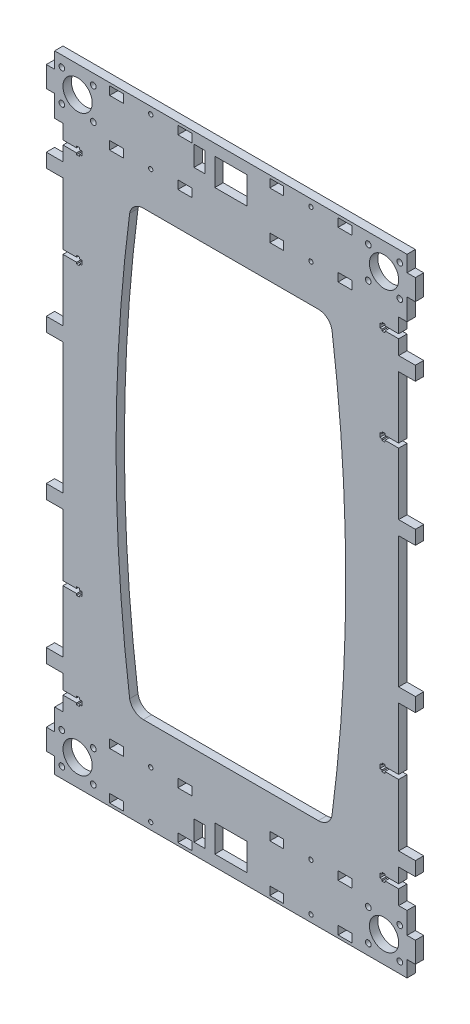
from build123d import *

# Parameters (mm, degrees)
SKETCH_1_R      = 1.55
SKETCH_1_R_2    = 2.05
SKETCH_1_R_3    = 10.5
SKETCH_1_W      = 10
SKETCH_1_H      = 6.000012
SKETCH_1_W_2    = 9.999998
SKETCH_1_H_2    = 5.999998
SKETCH_1_W_3    = 9.999999
SKETCH_1_W_4    = 8
SKETCH_1_H_3    = 14.5
SKETCH_1_W_5    = 23
SKETCH_1_H_4    = 19.5
EXTRUDE_1_DEPTH = 6


with BuildPart() as part:
    # Эскиз1 → Бобышка-Вытянуть1 (new body)
    with BuildSketch(Plane.XY):
        Polygon((-120.499999, 47), (-132.500001, 47), (-132.500001, 57), (-120.499999, 57), (-120.499999, 101.449999), (-110.699997, 101.449999), (-110.699997, 100.249999), (-108.499998, 100.249999), (-108.499998, 101.449999), (-107.000002, 101.449999), (-107.000002, 104.550001), (-108.499998, 104.550001), (-108.499998, 105.749999), (-110.699997, 105.749999), (-110.699997, 104.550001), (-120.499999, 104.550001), (-120.499999, 148.999997), (-132.500001, 148.999997), (-132.500001, 159.000003), (-120.499999, 159.000003), (-120.499999, 169.450001), (-110.7, 169.450001), (-110.7, 168.250003), (-108.5, 168.250003), (-108.5, 169.450001), (-106.999996, 169.450001), (-106.999996, 172.550001), (-108.5, 172.550001), (-108.5, 173.749999), (-110.7, 173.749999), (-110.7, 172.550001), (-120.499999, 172.550001), (-120.499999, 182.999999), (-126.499996, 182.999999), (-126.499996, 198.499993), (-132.499998, 198.499993), (-132.499998, 213.499994), (-126.499996, 213.499994), (-126.499996, 224.999995), (126.499997, 224.999995), (126.499997, 213.499994), (132.499999, 213.499994), (132.499999, 198.499993), (126.499997, 198.499993), (126.499997, 182.999999), (120.5, 182.999999), (120.5, 172.550001), (110.7, 172.550001), (110.7, 173.749999), (108.5, 173.749999), (108.5, 172.550001), (106.999997, 172.550001), (106.999997, 169.450001), (108.5, 169.450001), (108.5, 168.250003), (110.7, 168.250003), (110.7, 169.450001), (120.5, 169.450001), (120.5, 159.000003), (132.500002, 159.000003), (132.500002, 148.999997), (120.5, 148.999997), (120.5, 104.550001), (110.699998, 104.550001), (110.699998, 105.749999), (108.499998, 105.749999), (108.499998, 104.550001), (107.000003, 104.550001), (107.000003, 101.449999), (108.499998, 101.449999), (108.499998, 100.249999), (110.699998, 100.249999), (110.699998, 101.449999), (120.5, 101.449999), (120.5, 57), (132.500002, 57), (132.500002, 47), (120.5, 47), (120.499999, -47), (132.500001, -47), (132.500001, -57), (120.499999, -57), (120.499999, -101.449999), (110.699997, -101.449999), (110.699997, -100.249999), (108.499998, -100.249999), (108.499998, -101.449999), (107.000002, -101.449999), (107.000002, -104.550001), (108.499998, -104.550001), (108.499998, -105.749999), (110.699997, -105.749999), (110.699997, -104.550001), (120.499999, -104.550001), (120.499999, -148.999997), (132.500001, -148.999997), (132.500001, -159.000003), (120.499999, -159.000003), (120.499999, -169.450001), (110.7, -169.450001), (110.7, -168.250003), (108.5, -168.250003), (108.5, -169.450001), (106.999996, -169.450001), (106.999996, -172.550001), (108.5, -172.550001), (108.5, -173.749999), (110.7, -173.749999), (110.7, -172.550001), (120.499999, -172.550001), (120.499999, -182.999999), (126.499996, -182.999999), (126.499996, -198.499993), (132.499998, -198.499993), (132.499998, -213.499994), (126.499996, -213.499994), (126.499996, -224.999995), (-126.499997, -224.999995), (-126.499997, -213.499994), (-132.499999, -213.499994), (-132.499999, -198.499993), (-126.499997, -198.499993), (-126.499997, -182.999999), (-120.5, -182.999999), (-120.5, -172.550001), (-110.7, -172.550001), (-110.7, -173.749999), (-108.5, -173.749999), (-108.5, -172.550001), (-106.999997, -172.550001), (-106.999997, -169.450001), (-108.5, -169.450001), (-108.5, -168.250003), (-110.7, -168.250003), (-110.7, -169.450001), (-120.5, -169.450001), (-120.5, -159.000003), (-132.500002, -159.000003), (-132.500002, -148.999997), (-120.5, -148.999997), (-120.5, -104.550001), (-110.699998, -104.550001), (-110.699998, -105.749999), (-108.499998, -105.749999), (-108.499998, -104.550001), (-107.000003, -104.550001), (-107.000003, -101.449999), (-108.499998, -101.449999), (-108.499998, -100.249999), (-110.699998, -100.249999), (-110.699998, -101.449999), (-120.5, -101.449999), (-120.5, -57), (-132.500002, -57), (-132.500002, -47), (-120.5, -47), align=None)
        with Locations((-57.5, 186)):
            Circle(SKETCH_1_R, mode=Mode.SUBTRACT)
        with Locations((-98.7, 194.7)):
            Circle(SKETCH_1_R_2, mode=Mode.SUBTRACT)
        with Locations((-98.7, 217.3)):
            Circle(SKETCH_1_R_2, mode=Mode.SUBTRACT)
        with Locations((-110, 206)):
            Circle(SKETCH_1_R_3, mode=Mode.SUBTRACT)
        with Locations((-57.5, 220)):
            Circle(SKETCH_1_R, mode=Mode.SUBTRACT)
        with Locations((-121.3, 217.3)):
            Circle(SKETCH_1_R_2, mode=Mode.SUBTRACT)
        with Locations((-121.3, 194.7)):
            Circle(SKETCH_1_R_2, mode=Mode.SUBTRACT)
        with Locations((57.5, 186)):
            Circle(SKETCH_1_R, mode=Mode.SUBTRACT)
        with Locations((98.7, 194.7)):
            Circle(SKETCH_1_R_2, mode=Mode.SUBTRACT)
        with Locations((98.7, 217.3)):
            Circle(SKETCH_1_R_2, mode=Mode.SUBTRACT)
        with Locations((110, 206)):
            Circle(SKETCH_1_R_3, mode=Mode.SUBTRACT)
        with Locations((57.5, 220)):
            Circle(SKETCH_1_R, mode=Mode.SUBTRACT)
        with Locations((121.3, 217.3)):
            Circle(SKETCH_1_R_2, mode=Mode.SUBTRACT)
        with Locations((121.3, 194.7)):
            Circle(SKETCH_1_R_2, mode=Mode.SUBTRACT)
        with Locations((57.5, -186)):
            Circle(SKETCH_1_R, mode=Mode.SUBTRACT)
        with Locations((98.7, -194.7)):
            Circle(SKETCH_1_R_2, mode=Mode.SUBTRACT)
        with Locations((98.7, -217.3)):
            Circle(SKETCH_1_R_2, mode=Mode.SUBTRACT)
        with Locations((110, -206)):
            Circle(SKETCH_1_R_3, mode=Mode.SUBTRACT)
        with Locations((57.5, -220)):
            Circle(SKETCH_1_R, mode=Mode.SUBTRACT)
        with Locations((121.3, -217.3)):
            Circle(SKETCH_1_R_2, mode=Mode.SUBTRACT)
        with Locations((121.3, -194.7)):
            Circle(SKETCH_1_R_2, mode=Mode.SUBTRACT)
        with Locations((-57.5, -186)):
            Circle(SKETCH_1_R, mode=Mode.SUBTRACT)
        with Locations((-98.7, -194.7)):
            Circle(SKETCH_1_R_2, mode=Mode.SUBTRACT)
        with Locations((-98.7, -217.3)):
            Circle(SKETCH_1_R_2, mode=Mode.SUBTRACT)
        with Locations((-110, -206)):
            Circle(SKETCH_1_R_3, mode=Mode.SUBTRACT)
        with Locations((-57.5, -220)):
            Circle(SKETCH_1_R, mode=Mode.SUBTRACT)
        with Locations((-121.3, -217.3)):
            Circle(SKETCH_1_R_2, mode=Mode.SUBTRACT)
        with Locations((-121.3, -194.7)):
            Circle(SKETCH_1_R_2, mode=Mode.SUBTRACT)
        with Locations((-33, 220)):
            Rectangle(SKETCH_1_W, SKETCH_1_H, mode=Mode.SUBTRACT)
        with Locations((-81.999999, 220)):
            Rectangle(SKETCH_1_W_2, SKETCH_1_H, mode=Mode.SUBTRACT)
        with Locations((-81.999999, 185.999998)):
            Rectangle(SKETCH_1_W_2, SKETCH_1_H_2, mode=Mode.SUBTRACT)
        with Locations((-33, 185.999998)):
            Rectangle(SKETCH_1_W, SKETCH_1_H_2, mode=Mode.SUBTRACT)
        with Locations((33.0000005, 220)):
            Rectangle(SKETCH_1_W_3, SKETCH_1_H, mode=Mode.SUBTRACT)
        with Locations((82, 220)):
            Rectangle(SKETCH_1_W_2, SKETCH_1_H, mode=Mode.SUBTRACT)
        with Locations((82, 185.999998)):
            Rectangle(SKETCH_1_W_2, SKETCH_1_H_2, mode=Mode.SUBTRACT)
        with Locations((33.0000005, 185.999998)):
            Rectangle(SKETCH_1_W_3, SKETCH_1_H_2, mode=Mode.SUBTRACT)
        with BuildLine():
            Line((-62.821716435, 159.000003), (62.836137179, 159.000003))
            ThreePointArc((62.836137179, 159.000003), (69.194958154, 156.717865126), (72.651437894, 150.913082161))
            ThreePointArc((72.651437894, 150.913082161), (82.494136903, 0.007822591), (72.640195344, -150.89670327))
            ThreePointArc((72.640195344, -150.89670327), (69.18697359, -156.712557787), (62.821716435, -159.000003))
            Line((62.821716435, -159.000003), (-62.836137179, -159.000003))
            ThreePointArc((-62.836137179, -159.000003), (-69.194958154, -156.717865126), (-72.651437894, -150.913082161))
            ThreePointArc((-72.651437894, -150.913082161), (-82.395165597, -0.007826278), (-72.640195344, 150.89670327))
            ThreePointArc((-72.640195344, 150.89670327), (-69.18697359, 156.712557787), (-62.821716435, 159.000003))
        make_face(mode=Mode.SUBTRACT)
        with Locations((-22.5, 209.749994)):
            Rectangle(SKETCH_1_W_4, SKETCH_1_H_3, mode=Mode.SUBTRACT)
        with Locations((-2e-06, 207.249994)):
            Rectangle(SKETCH_1_W_5, SKETCH_1_H_4, mode=Mode.SUBTRACT)
        with Locations((33, -220)):
            Rectangle(SKETCH_1_W, SKETCH_1_H, mode=Mode.SUBTRACT)
        with Locations((81.999999, -220)):
            Rectangle(SKETCH_1_W_2, SKETCH_1_H, mode=Mode.SUBTRACT)
        with Locations((81.999999, -185.999998)):
            Rectangle(SKETCH_1_W_2, SKETCH_1_H_2, mode=Mode.SUBTRACT)
        with Locations((33, -185.999998)):
            Rectangle(SKETCH_1_W, SKETCH_1_H_2, mode=Mode.SUBTRACT)
        with Locations((-33.0000005, -220)):
            Rectangle(SKETCH_1_W_3, SKETCH_1_H, mode=Mode.SUBTRACT)
        with Locations((-82, -220)):
            Rectangle(SKETCH_1_W_2, SKETCH_1_H, mode=Mode.SUBTRACT)
        with Locations((-82, -185.999998)):
            Rectangle(SKETCH_1_W_2, SKETCH_1_H_2, mode=Mode.SUBTRACT)
        with Locations((-33.0000005, -185.999998)):
            Rectangle(SKETCH_1_W_3, SKETCH_1_H_2, mode=Mode.SUBTRACT)
        with Locations((-22.5, -209.749994)):
            Rectangle(SKETCH_1_W_4, SKETCH_1_H_3, mode=Mode.SUBTRACT)
        with Locations((-2e-06, -207.249994)):
            Rectangle(SKETCH_1_W_5, SKETCH_1_H_4, mode=Mode.SUBTRACT)
    extrude(amount=EXTRUDE_1_DEPTH)


solid = part.part
